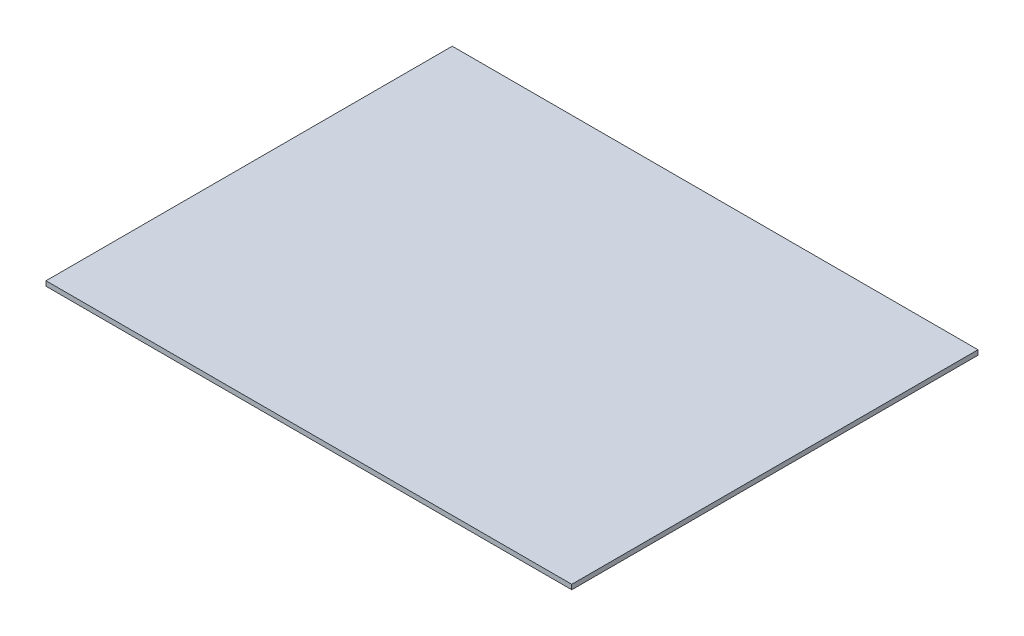
from build123d import *

# Parameters (mm, degrees)
SKETCH1_W           = 279.4
SKETCH1_H           = 215.9
BOSS_EXTRUDE1_DEPTH = 2.54


with BuildPart() as part:
    # Sketch1 → Boss-Extrude1 (new body)
    with BuildSketch(Plane(origin=(0, 0, 0), x_dir=(1, 0, 0), z_dir=(0, 1, 0))):
        with Locations((-45.55755814, -63.075436047)):
            Rectangle(SKETCH1_W, SKETCH1_H)
    extrude(amount=BOSS_EXTRUDE1_DEPTH)


solid = part.part
